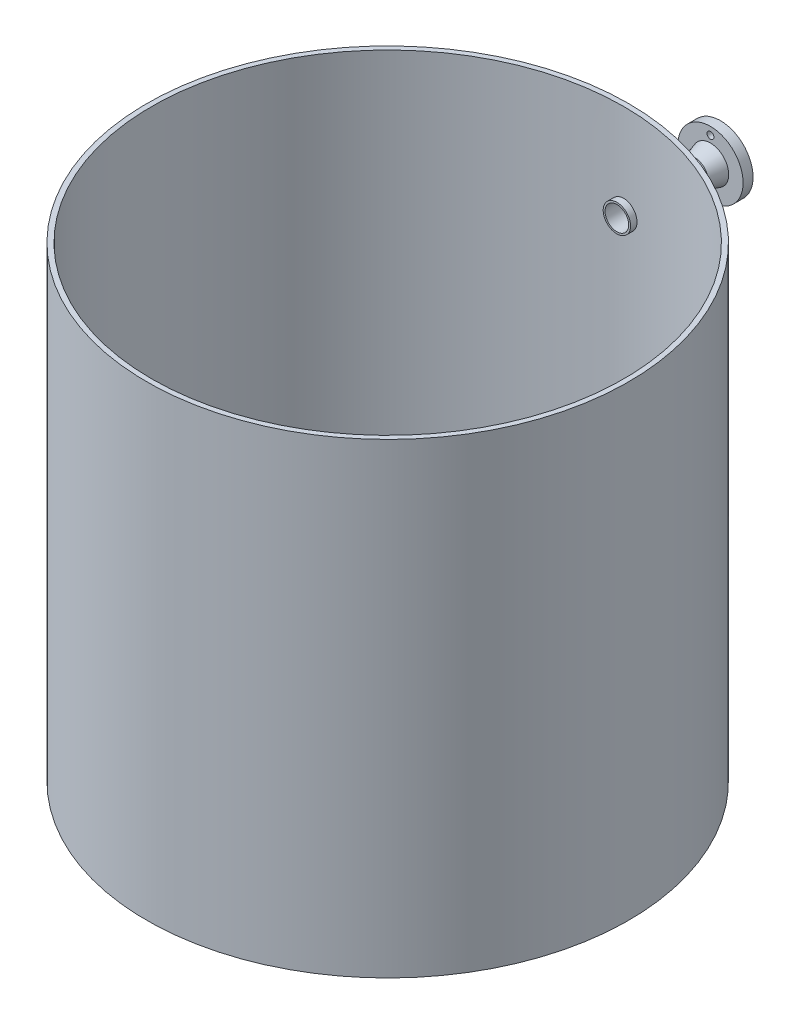
from build123d import *

# Parameters (mm, degrees)
SKETCH1_W          = 16
SKETCH1_H          = 1500
SKETCH3_R          = 11
CUT_EXTRUDE1_DEPTH = 32
CUT_EXTRUDE2_START = -400
SKETCH4_R          = 38
CUT_EXTRUDE2_DEPTH = 400


with BuildPart() as part:
    # Sketch1 → Revolve1 (revolve)
    with BuildSketch(Plane.XY, mode=Mode.PRIVATE) as revolve1_sk:
        with Locations((767, 750)):
            Rectangle(SKETCH1_W, SKETCH1_H)
    revolve(revolve1_sk.sketch.rotate(Axis((0, 0, 0), (0, 1, 0)), 90), axis=Axis((0, 0, 0), (0, 1, 0)))

    # Sketch2 → Revolve2 (revolve)
    with BuildSketch(Plane(origin=(0, 0, 0), x_dir=(0, 0, -1), z_dir=(1, 0, 0)), mode=Mode.PRIVATE) as revolve2_sk:
        Polygon((1070, 1238), (737, 1238), (737, 1244), (987, 1244), (1038, 1258.624014674), (1038, 1305), (1070, 1305), align=None)
    revolve(revolve2_sk.sketch.rotate(Axis((0, 1200, -775), (0, 0, -1)), 90), axis=Axis((0, 1200, -775), (0, 0, -1)))

    # Sketch3 → Cut-Extrude1 (cut)
    with BuildSketch(Plane(origin=(0, 0, -1070), x_dir=(-1, 0, 0), z_dir=(0, 0, -1))):
        with Locations((0, 1280)):
            Circle(SKETCH3_R)
        with Locations((0, 1120)):
            Circle(SKETCH3_R)
    extrude(amount=-CUT_EXTRUDE1_DEPTH, mode=Mode.SUBTRACT)

    # Sketch4 → Cut-Extrude2 (cut)
    with BuildSketch(Plane(origin=(0, 0, -1070), x_dir=(-1, 0, 0), z_dir=(0, 0, -1)).offset(CUT_EXTRUDE2_START)):
        with Locations(Location((0, 1200, 0), (0, 0, 180))):
            Circle(SKETCH4_R)
    extrude(amount=CUT_EXTRUDE2_DEPTH, mode=Mode.SUBTRACT)


solid = part.part
